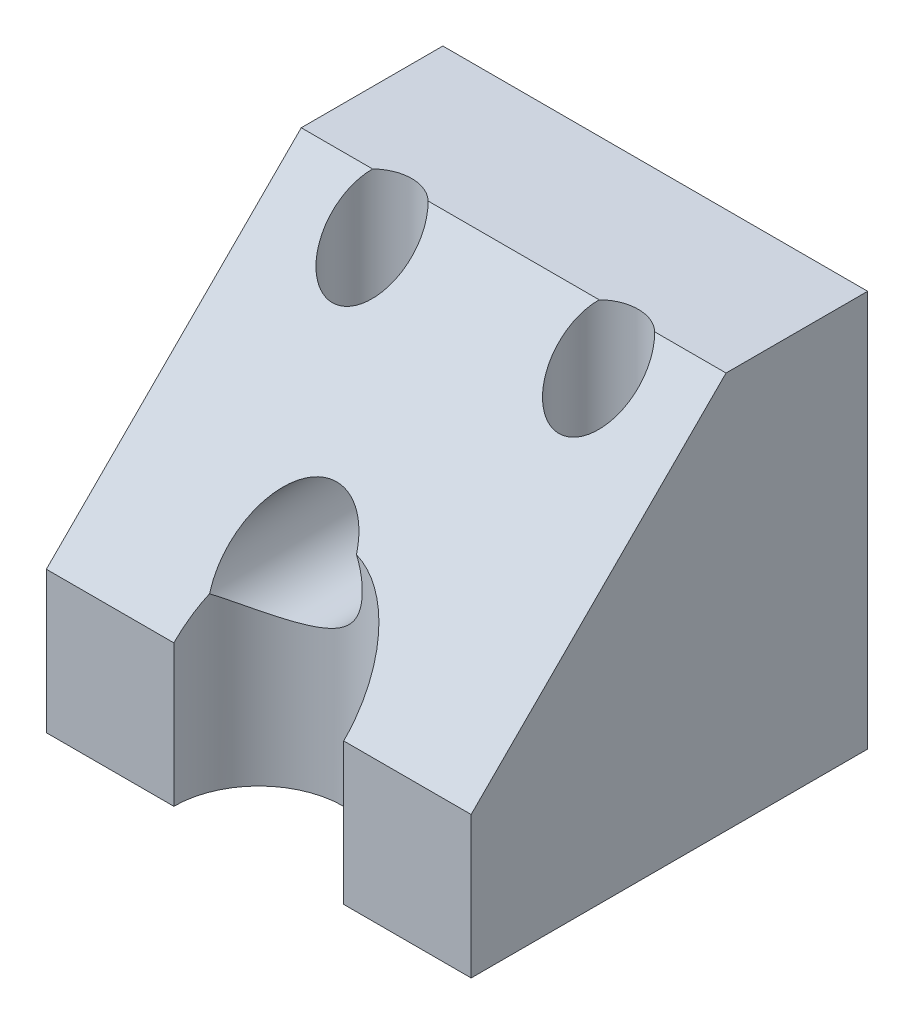
from build123d import *

# Parameters (mm, degrees)
EXTRUDE_1_DEPTH          = 15
CUT_EXTRUDE_1_DEPTH      = 25.839484697
CUT_EXTRUDE_1_DEPTH_BACK = 25.839484697
SKETCH_2_R               = 1.4
SKETCH_3_R               = 1.9
CUT_EXTRUDE_2_DEPTH      = 25.839484697
CUT_EXTRUDE_3_DEPTH      = 25.839484753
CUT_EXTRUDE_3_DEPTH_BACK = 25.839484753
SKETCH_4_R               = 3


with BuildPart() as part:
    # 草图1 → 凸台-拉伸1 (new body)
    with BuildSketch(Plane(origin=(0, 0, 0), x_dir=(0, 0, -1), z_dir=(1, 0, 0))):
        Polygon((-14, 0), (0, 0), (0, 14), (-5, 14), (-14, 5), align=None)
    extrude(amount=EXTRUDE_1_DEPTH)

    # 草图2 → 切除-拉伸1 (cut, two sides: drawn at the far end of the back side and taken through both)
    with BuildSketch(Plane.XZ.offset(-CUT_EXTRUDE_1_DEPTH_BACK)):
        with Locations(Location((11.5, 6, 0), (0, 0, 225.584691403))):
            Circle(SKETCH_2_R)
        with Locations(Location((3.5, 6, 0), (0, 0, 225.584691403))):
            Circle(SKETCH_2_R)
    extrude(amount=CUT_EXTRUDE_1_DEPTH + CUT_EXTRUDE_1_DEPTH_BACK, mode=Mode.SUBTRACT)

    # 草图3 → 切除-拉伸2 (cut, through all)
    with BuildSketch(Plane(origin=(0, 0, 0), x_dir=(-1, 0, 0), z_dir=(0, 0, -1))):
        with Locations((-6.35, 7)):
            Circle(SKETCH_3_R)
    extrude(amount=-CUT_EXTRUDE_2_DEPTH, mode=Mode.SUBTRACT)

    # 草图4 → 切除-拉伸3 (cut, two sides: drawn at the far end of the back side and taken through both)
    with BuildSketch(Plane.XZ.offset(-CUT_EXTRUDE_3_DEPTH_BACK)):
        with Locations((7.5, 14)):
            Circle(SKETCH_4_R)
    extrude(amount=CUT_EXTRUDE_3_DEPTH + CUT_EXTRUDE_3_DEPTH_BACK, mode=Mode.SUBTRACT)


solid = part.part
